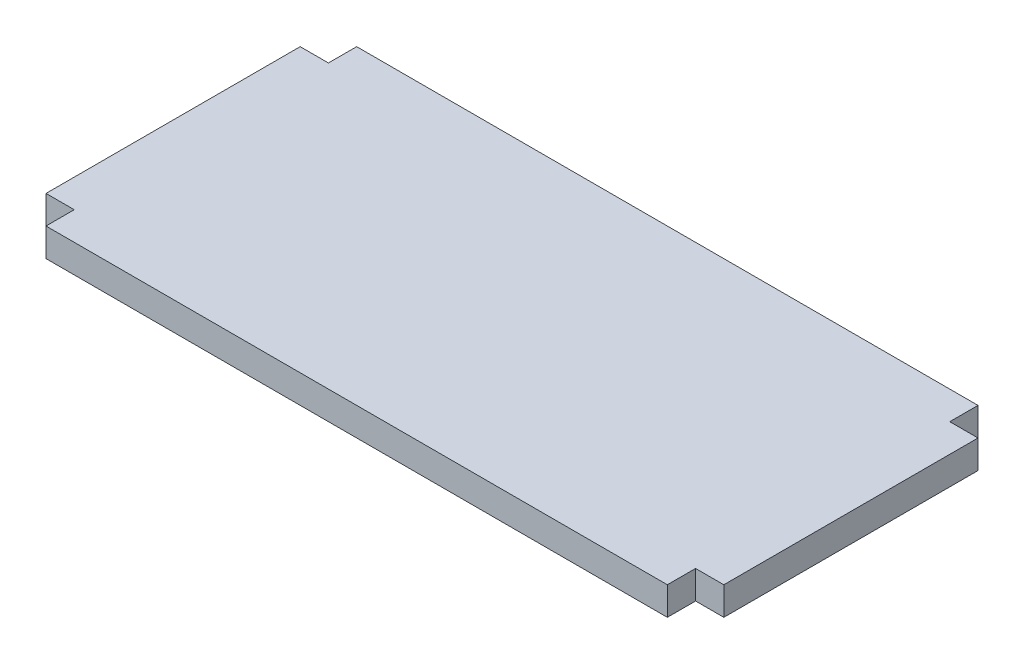
from build123d import *

# Parameters (mm, degrees)
SALIENTE_EXTRUIR1_DEPTH = 50


with BuildPart() as part:
    # Croquis1 → Saliente-Extruir1 (new body)
    with BuildSketch(Plane(origin=(0, 0, 0), x_dir=(1, 0, 0), z_dir=(0, 1, 0))):
        Polygon((550, 225), (550, 275), (-550, 275), (-550, 225), (-600, 225), (-600, -225), (-550, -225), (-550, -275), (550, -275), (550, -225), (600, -225), (600, 225), align=None)
    extrude(amount=SALIENTE_EXTRUIR1_DEPTH)


solid = part.part
